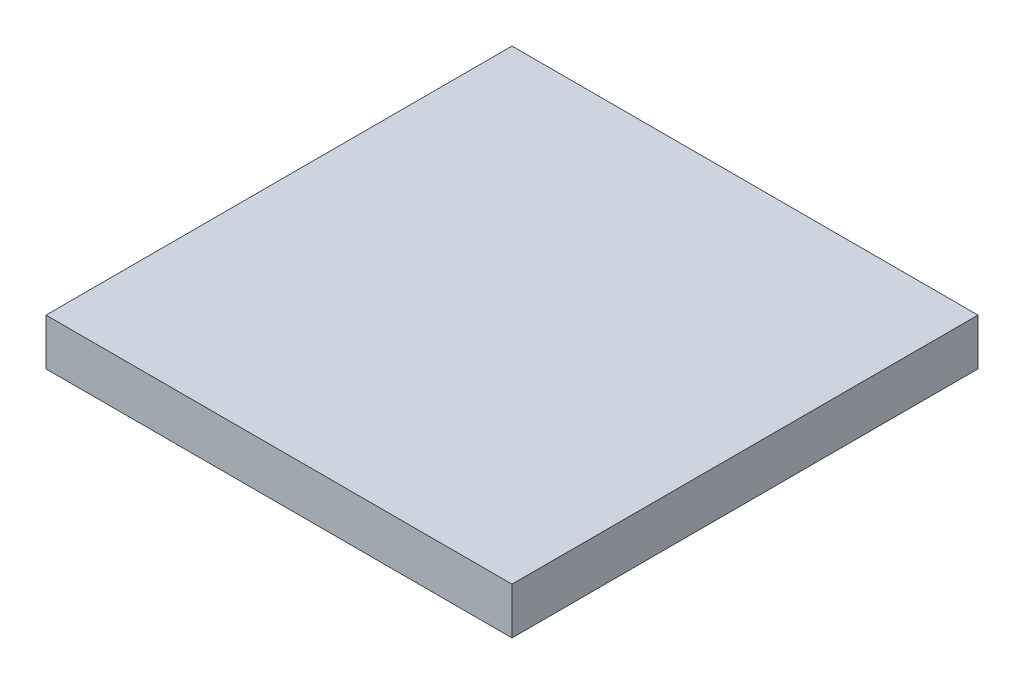
from build123d import *

# Parameters (mm, degrees)
SKETCH1_W           = 42
SKETCH1_H           = 42
BOSS_EXTRUDE1_DEPTH = 4.2


with BuildPart() as part:
    # Sketch1 → Boss-Extrude1 (new body)
    with BuildSketch(Plane(origin=(0, 0, 0), x_dir=(1, 0, 0), z_dir=(0, 1, 0))):
        Rectangle(SKETCH1_W, SKETCH1_H)
    extrude(amount=BOSS_EXTRUDE1_DEPTH)


solid = part.part
